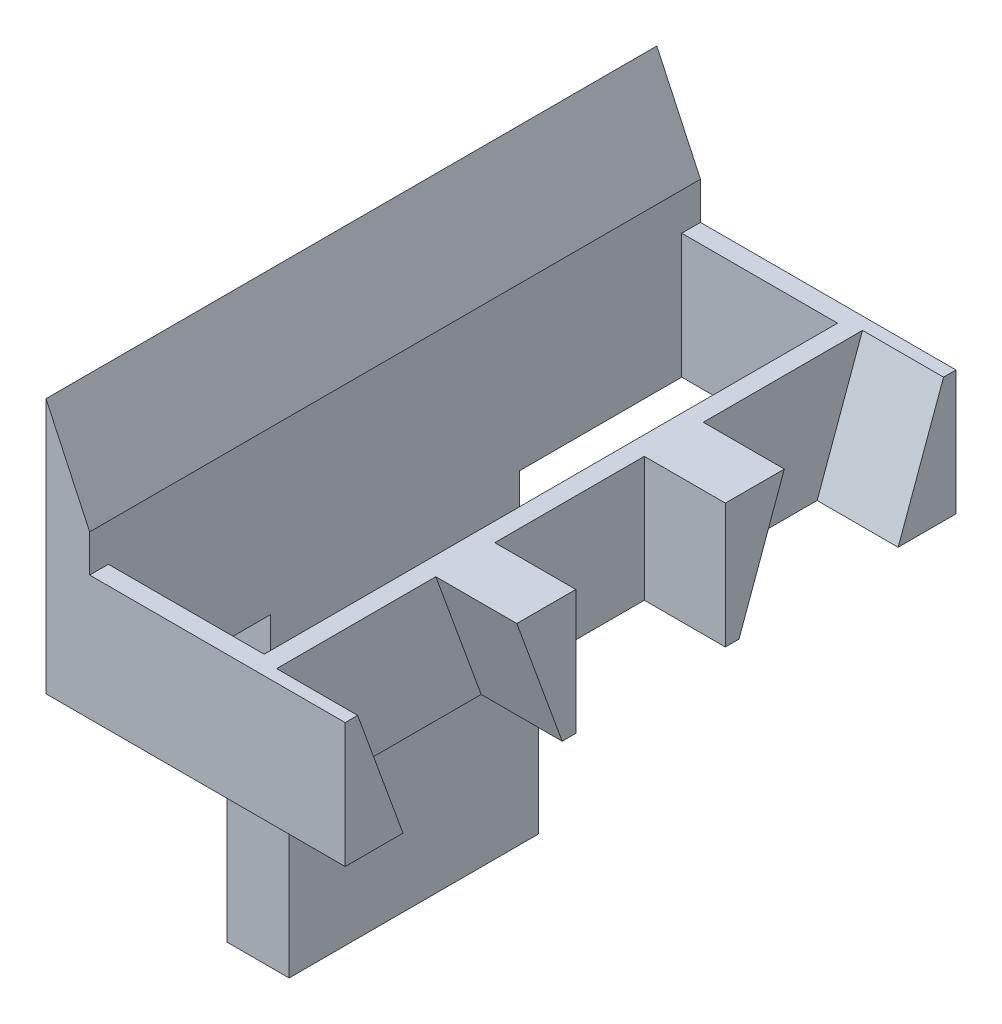
from build123d import *

# Parameters (mm, degrees)
SALIENTE_EXTRUIR1_DEPTH = 49
CORTAR_EXTRUIR1_DEPTH   = 70.738798384
SALIENTE_EXTRUIR3_DEPTH = 10
CROQUIS8_W              = 12
CROQUIS8_H              = 10
CORTAR_EXTRUIR2_DEPTH   = 6.5
CROQUIS9_W              = 20
CROQUIS9_H              = 12
SALIENTE_EXTRUIR4_DEPTH = 1.5


with BuildPart() as part:
    # Croquis1 → Saliente-Extruir1 (new body)
    with BuildSketch(Plane.XY):
        Polygon((-3.5, 49.5), (-3.5, 0), (0, 0), (0, 41.994225778), align=None)
    extrude(amount=SALIENTE_EXTRUIR1_DEPTH)

    # Croquis2 → Cortar-Extruir1 (cut, through all)
    with BuildSketch(Plane(origin=(0, 0, 0), x_dir=(0, 0, -1), z_dir=(1, 0, 0))):
        Polygon((-49, 0), (0, 0), (0, 28.994225778), (-14.5, 28.994225778), (-14.5, 4.5), (-34.5, 4.5), (-34.5, 28.994225778), (-49, 28.994225778), align=None)
    extrude(amount=-CORTAR_EXTRUIR1_DEPTH, mode=Mode.SUBTRACT)

    # Croquis4 → Saliente-Extruir3 (add)
    with BuildSketch(Plane.XZ.offset(-28.994225778)):
        Polygon((0, 49), (20.5, 49), (20.5, 0), (0, 0), (0, 1.5), (12.5, 1.5), (12.5, 47.5), (0, 47.5), align=None)
    extrude(amount=-SALIENTE_EXTRUIR3_DEPTH)

    # Croquis8 → Cortar-Extruir2 (cut)
    with BuildSketch(Plane(origin=(20.5, 0, 0), x_dir=(0, 0, -1), z_dir=(1, 0, 0))):
        with Locations((-24.5, 33.994225778)):
            Rectangle(CROQUIS8_W, CROQUIS8_H)
        Polygon((-48, 38.994225778), (-44.360297657, 28.994225778), (-31.590164388, 28.994225778), (-35.22986673, 38.994225778), align=None)
        Polygon((-17.409835612, 28.994225778), (-4.639702343, 28.994225778), (-1, 38.994225778), (-13.77013327, 38.994225778), align=None)
    extrude(amount=-CORTAR_EXTRUIR2_DEPTH, mode=Mode.SUBTRACT)

    # Croquis9 → Saliente-Extruir4 (add)
    with BuildSketch(Plane(origin=(0, 0, 0), x_dir=(0, 0, -1), z_dir=(1, 0, 0))):
        with Locations((-24.5, 10.5)):
            Rectangle(CROQUIS9_W, CROQUIS9_H)
    extrude(amount=SALIENTE_EXTRUIR4_DEPTH)


solid = part.part
